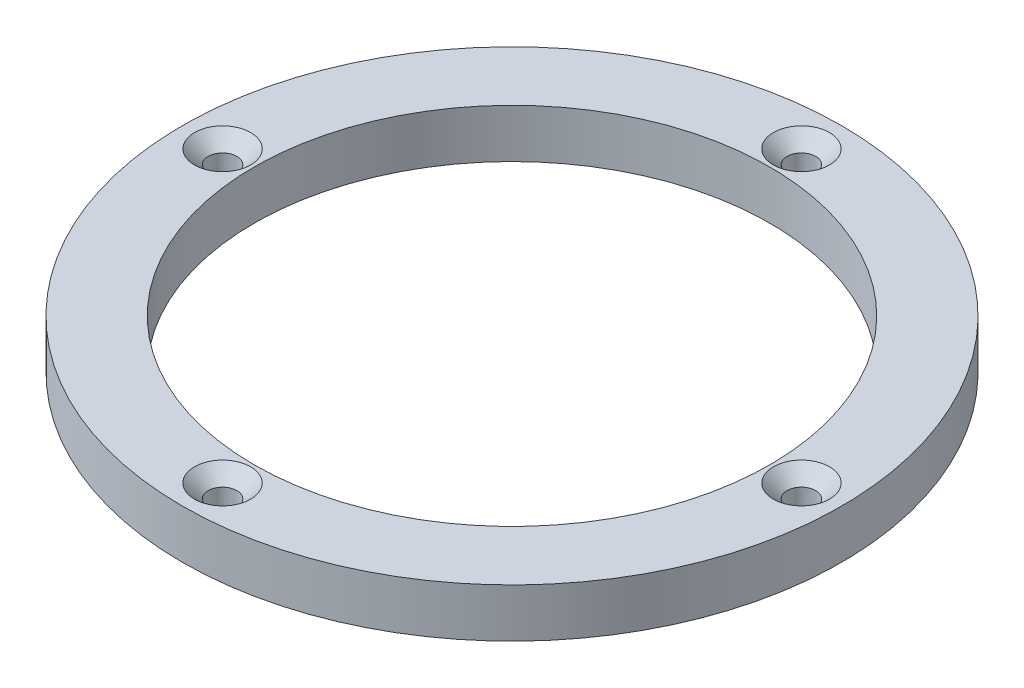
from build123d import *

# Parameters (mm, degrees)
SKETCH_1_R               = 57.5
SKETCH_1_R_2             = 45
SKETCH_1_R_3             = 2.5
EXTRUDE_1_DEPTH          = 8.5
PATTERN_CIRCULAR_1_COUNT = 4


with BuildPart() as part:
    # 草图1 → 凸台-拉伸1 (new body)
    with BuildSketch(Plane(origin=(0, 0, 0), x_dir=(1, 0, 0), z_dir=(0, 1, 0))):
        Circle(SKETCH_1_R)
        Circle(SKETCH_1_R_2, mode=Mode.SUBTRACT)
        with Locations((0, 50.5)):
            Circle(SKETCH_1_R_3, mode=Mode.SUBTRACT)
        with Locations((50.5, 0)):
            Circle(SKETCH_1_R_3, mode=Mode.SUBTRACT)
        with Locations((0, -50.5)):
            Circle(SKETCH_1_R_3, mode=Mode.SUBTRACT)
        with Locations((-50.5, 0)):
            Circle(SKETCH_1_R_3, mode=Mode.SUBTRACT)
    extrude(amount=-EXTRUDE_1_DEPTH)

    # 草图2 → 切除-旋转1 (revolve, cut)
    with BuildSketch(Plane.XY.offset(-50.5)):
        Polygon((0, 0), (4.9, 0), (1.6, -3.3), (0, -3.3), align=None)
    cut_revolve_1 = revolve(axis=Axis((0, -3.3, -50.5), (0, 1, 0)), mode=Mode.SUBTRACT)

    # 阵列(圆周)1: 切除-旋转1 ×4 about axis
    pattern_circular_1_axis = Axis((0, -8.5, 0), (0, 1, 0))
    for i in range(1, PATTERN_CIRCULAR_1_COUNT):
        add(cut_revolve_1.rotate(pattern_circular_1_axis, i * 360 / PATTERN_CIRCULAR_1_COUNT), mode=Mode.SUBTRACT)


solid = part.part
